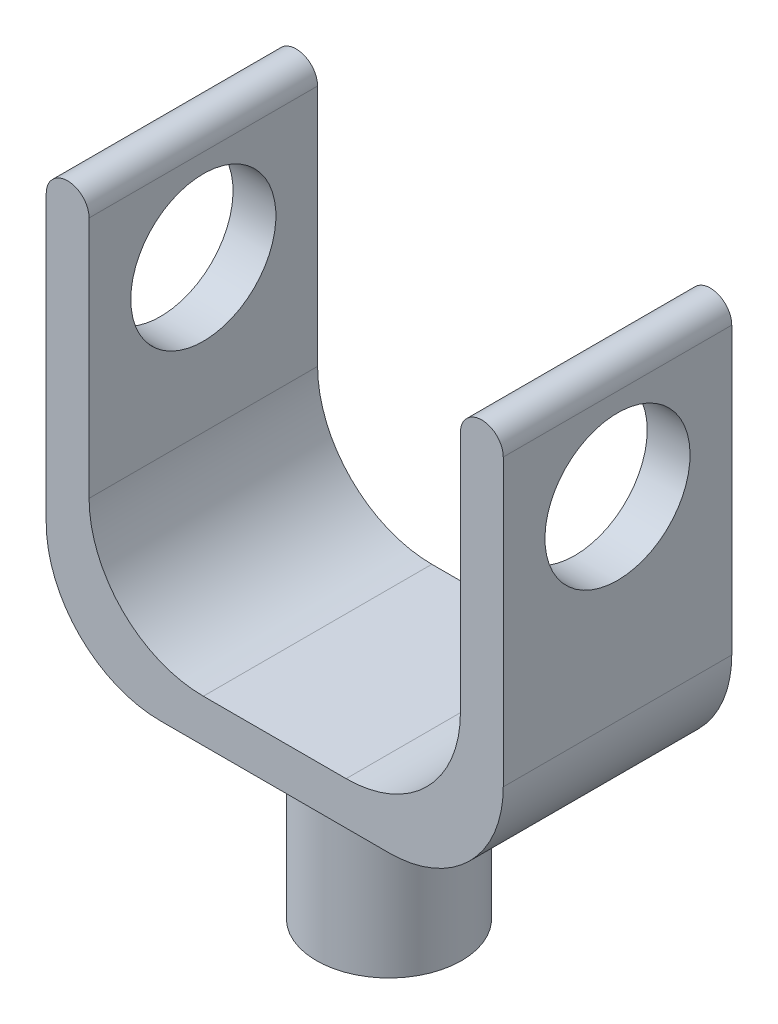
from build123d import *

# Parameters (mm, degrees)
BOSS_EXTRUDE1_DEPTH     = 20
SKETCH2_R               = 12.7
BOSS_EXTRUDE2_DEPTH     = 30
FILLET1_R               = 20
CUT_EXTRUDE1_DEPTH      = 111.630296483
CUT_EXTRUDE1_DEPTH_BACK = 111.630296483
SKETCH3_R               = 12.7


with BuildPart() as part:
    # Sketch1 → Boss-Extrude1 (new, symmetric)
    with BuildSketch(Plane.XY):
        with BuildLine():
            Line((-40, 70), (-40, 0))
            Line((-40, 0), (40, 0))
            Line((40, 0), (40, 70))
            ThreePointArc((40, 70), (36.25, 73.75), (32.5, 70))
            Line((32.5, 70), (32.5, 7.5))
            Line((32.5, 7.5), (-32.5, 7.5))
            Line((-32.5, 7.5), (-32.5, 70))
            ThreePointArc((-32.5, 70), (-36.25, 73.75), (-40, 70))
        make_face()
    extrude(amount=BOSS_EXTRUDE1_DEPTH, both=True)

    # Sketch2 → Boss-Extrude2 (add)
    with BuildSketch(Plane(origin=(0, 0, 0), x_dir=(-1, 0, 0), z_dir=(0, -1, 0))):
        with Locations(Location((0, 0, 0), (0, 0, 180))):
            Circle(SKETCH2_R)
    extrude(amount=BOSS_EXTRUDE2_DEPTH)

    # Fillet1
    fillet1_edges = [part.edges().sort_by_distance(p)[0] for p in [
        (-32.5, 7.5, 0),
        (32.5, 7.5, 0),
        (40, 0, 0),
        (-40, 0, 0),
    ]]
    fillet(fillet1_edges, radius=FILLET1_R)

    # Sketch3 → Cut-Extrude1 (cut, two sides: drawn at the far end of the back side and taken through both)
    with BuildSketch(Plane.ZY.offset(40).offset(-CUT_EXTRUDE1_DEPTH_BACK)):
        with Locations((0, 54)):
            Circle(SKETCH3_R)
    extrude(amount=CUT_EXTRUDE1_DEPTH + CUT_EXTRUDE1_DEPTH_BACK, mode=Mode.SUBTRACT)


solid = part.part
